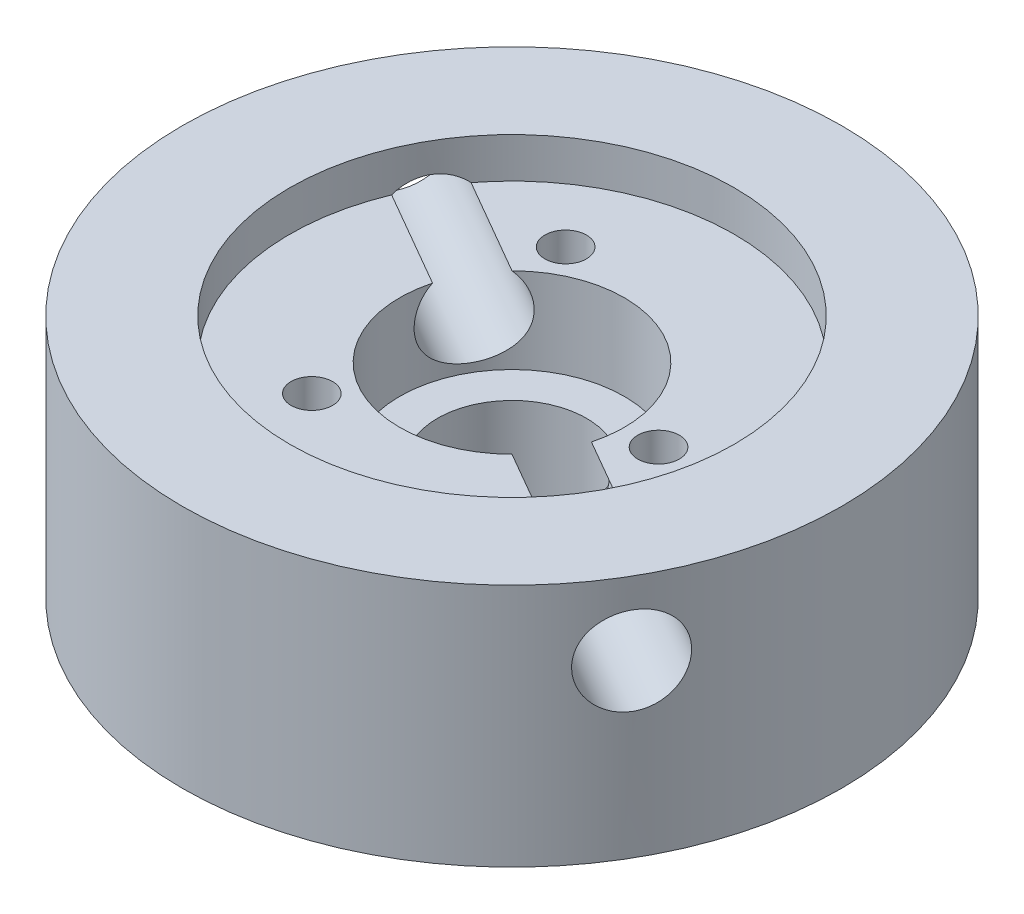
from build123d import *

# Parameters (mm, degrees)
TYRE_SEAT_BLANK_SKETCH_R        = 27
TYRE_SEAT_BLANK_DEPTH           = 20
AXLE_CLEARANCE_SKETCH_R         = 6.1
AXLE_CLEARANCE_DEPTH            = 20.2
HUB_NECK_SOCKET_SKETCH_R        = 9.2
HUB_NECK_SOCKET_DEPTH           = 10.5
HUB_FLANGE_SOCKET_SKETCH_R      = 18.2
HUB_FLANGE_SOCKET_DEPTH         = 3.5
RIM_BOLT_PATTERN_SKETCH_R       = 1.7
RIM_BOLT_PATTERN_DEPTH          = 20.2
RIM_NUT_POCKETS_DEPTH           = 2.7
HUB_PIN_SERVICE_WINDOW_SKETCH_R = 3.6
HUB_PIN_SERVICE_WINDOW_DEPTH    = 56


with BuildPart() as part:
    # Tyre seat blank sketch → Tyre seat blank (new body)
    with BuildSketch(Plane(origin=(0, -283, 0), x_dir=(1, 0, 0), z_dir=(0, 1, 0))):
        with Locations(Location((-19.009182883, 53.244882879, 0), (0, 0, 270))):
            Circle(TYRE_SEAT_BLANK_SKETCH_R)
    extrude(amount=TYRE_SEAT_BLANK_DEPTH)

    # Axle clearance sketch → Axle clearance (cut)
    with BuildSketch(Plane(origin=(0, -283.1, 0), x_dir=(1, 0, 0), z_dir=(0, 1, 0))):
        with Locations(Location((-19.009182883, 53.244882879, 0), (0, 0, 270))):
            Circle(AXLE_CLEARANCE_SKETCH_R)
    extrude(amount=AXLE_CLEARANCE_DEPTH, mode=Mode.SUBTRACT)

    # Hub neck socket sketch → Hub neck socket (cut)
    with BuildSketch(Plane(origin=(0, -273.3, 0), x_dir=(1, 0, 0), z_dir=(0, 1, 0))):
        with Locations(Location((-19.009182883, 53.244882879, 0), (0, 0, 90))):
            Circle(HUB_NECK_SOCKET_SKETCH_R)
    extrude(amount=HUB_NECK_SOCKET_DEPTH, mode=Mode.SUBTRACT)

    # Hub flange socket sketch → Hub flange socket (cut)
    with BuildSketch(Plane(origin=(0, -266.3, 0), x_dir=(1, 0, 0), z_dir=(0, 1, 0))):
        with Locations(Location((-19.009182883, 53.244882879, 0), (0, 0, 270))):
            Circle(HUB_FLANGE_SOCKET_SKETCH_R)
    extrude(amount=HUB_FLANGE_SOCKET_DEPTH, mode=Mode.SUBTRACT)

    # Rim bolt pattern sketch → Rim bolt pattern (cut)
    with BuildSketch(Plane(origin=(0, -283.1, 0), x_dir=(1, 0, 0), z_dir=(0, 1, 0))):
        with Locations(Location((-7.009182883, 53.244882879, 0), (0, 0, 270))):
            Circle(RIM_BOLT_PATTERN_SKETCH_R)
        with Locations(Location((-25.009182883, 42.852578033, 0), (0, 0, 270))):
            Circle(RIM_BOLT_PATTERN_SKETCH_R)
        with Locations(Location((-25.009182883, 63.637187724, 0), (0, 0, 270))):
            Circle(RIM_BOLT_PATTERN_SKETCH_R)
    extrude(amount=RIM_BOLT_PATTERN_DEPTH, mode=Mode.SUBTRACT)

    # Rim nut pockets sketch → Rim nut pockets (cut)
    with BuildSketch(Plane(origin=(0, -283.1, 0), x_dir=(1, 0, 0), z_dir=(0, 1, 0))):
        Polygon((-3.709182883, 53.244882879), (-5.359182883, 56.102766711), (-8.659182883, 56.102766711), (-10.309182883, 53.244882879), (-8.659182883, 50.386999046), (-5.359182883, 50.386999046), align=None)
        Polygon((-21.709182883, 42.852578033), (-23.359182883, 45.710461866), (-26.659182883, 45.710461866), (-28.309182883, 42.852578033), (-26.659182883, 39.994694201), (-23.359182883, 39.994694201), align=None)
        Polygon((-21.709182883, 63.637187724), (-23.359182883, 66.495071557), (-26.659182883, 66.495071557), (-28.309182883, 63.637187724), (-26.659182883, 60.779303892), (-23.359182883, 60.779303892), align=None)
    extrude(amount=RIM_NUT_POCKETS_DEPTH, mode=Mode.SUBTRACT)

    # Hub pin service window sketch → Hub pin service window (cut)
    with BuildSketch(Plane(origin=(-61.561309066, 0, -35.542438361), x_dir=(0.4999999999999994, 0, -0.866025403784439), z_dir=(0.866025403784439, 0, 0.4999999999999994))):
        with Locations(Location((36.606829753, -269, 0), (0, 0, 180))):
            Circle(HUB_PIN_SERVICE_WINDOW_SKETCH_R)
    extrude(amount=HUB_PIN_SERVICE_WINDOW_DEPTH, mode=Mode.SUBTRACT)


solid = part.part
